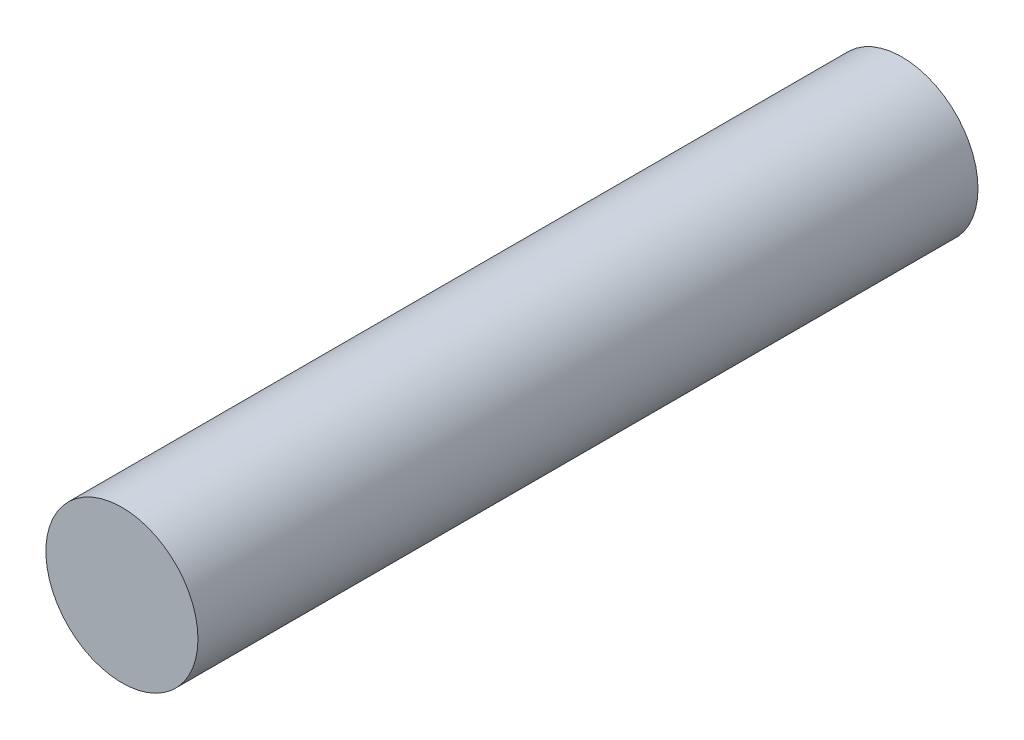
from build123d import *

# Parameters (mm, degrees)
SKETCH1_R           = 1.95
BOSS_EXTRUDE1_DEPTH = 20


with BuildPart() as part:
    # Sketch1 → Boss-Extrude1 (new body)
    with BuildSketch(Plane.XY):
        Circle(SKETCH1_R)
    extrude(amount=BOSS_EXTRUDE1_DEPTH)


solid = part.part
